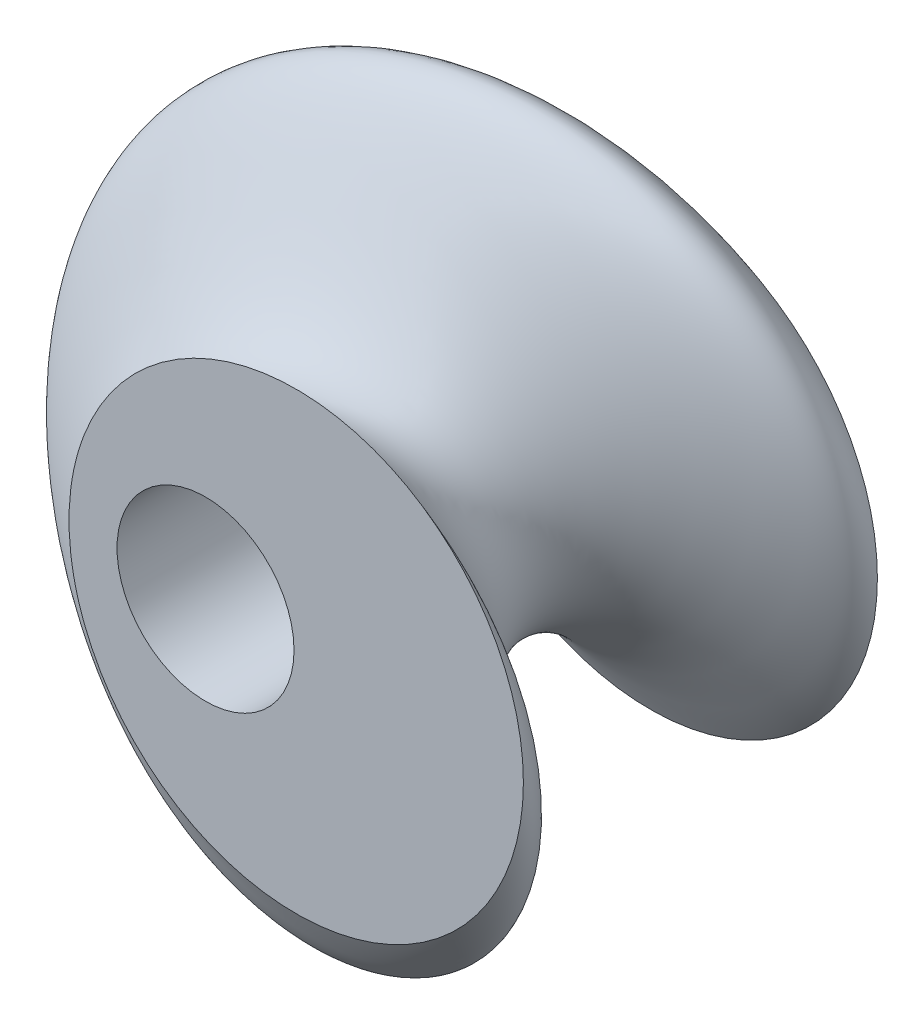
from build123d import *

# Parameters (mm, degrees)
AUSTRAGUNG1_PITCH               = 10
AUSTRAGUNG1_HEIGHT              = 10
AUSTRAGUNG1_RADIUS              = 3.593389333
SKIZZE1_R                       = 6.417321625
SKIZZE5_R                       = 2.5
SCHNITT_LINEAR_AUSTRAGEN1_DEPTH = 10


with BuildPart() as part:
    # Austragung1: sweep along a helix
    with BuildLine() as austragung1_path:
        Helix(AUSTRAGUNG1_PITCH, AUSTRAGUNG1_HEIGHT, AUSTRAGUNG1_RADIUS, center=(-2.561325, 0, 0), direction=(0, 0, 1))
    # Skizze1 → Austragung1 (sweep)
    with BuildSketch(Plane.XY):
        Circle(SKIZZE1_R)
    sweep(path=austragung1_path.line, is_frenet=True)

    # Skizze5 → Schnitt-Linear austragen1 (cut)
    with BuildSketch(Plane.XY.offset(10)):
        with Locations((-2.561325, 0)):
            Circle(SKIZZE5_R)
    extrude(amount=-SCHNITT_LINEAR_AUSTRAGEN1_DEPTH, mode=Mode.SUBTRACT)


solid = part.part
